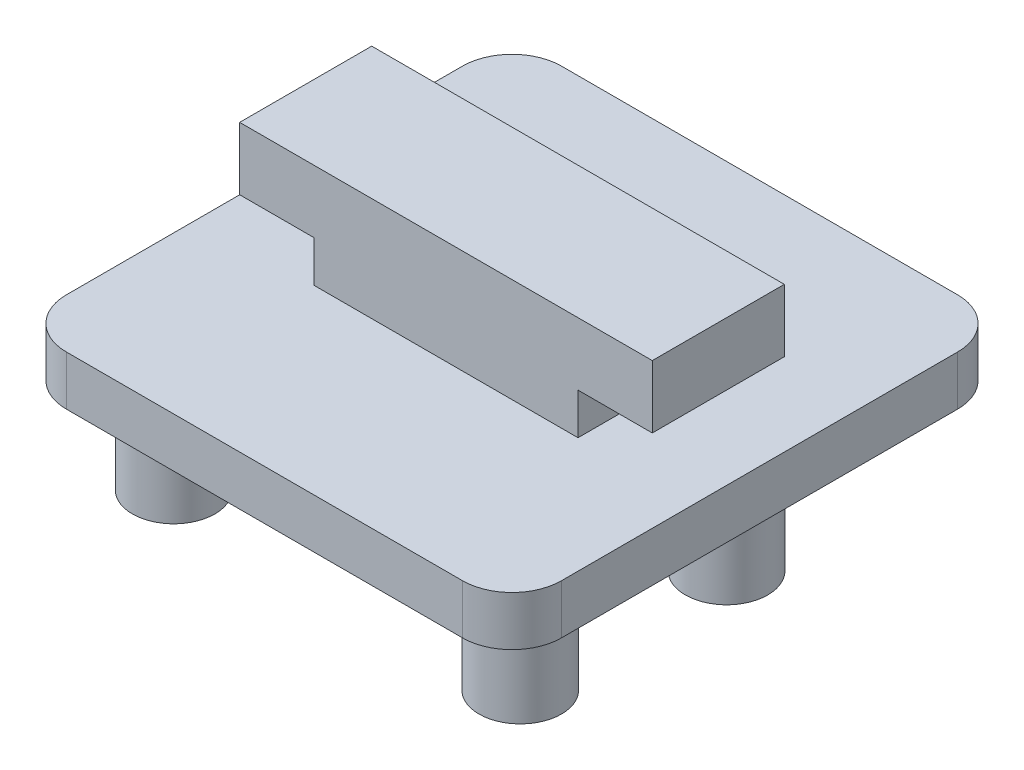
from build123d import *

# Parameters (mm, degrees)
EXTRUDE_2_DEPTH = 3
SKETCH_4_R      = 2.5
SKETCH_4_R_2    = 0.95
SKETCH_4_R_3    = 0.973149492
EXTRUDE_5_DEPTH = 6
SKETCH_6_W      = 16
SKETCH_6_H      = 8
EXTRUDE_6_DEPTH = 2.5
EXTRUDE_7_DEPTH = 3.8


with BuildPart() as part:
    # Эскиз1 → Бобышка-Вытянуть2 (new body)
    with BuildSketch(Plane(origin=(0, 0, 0), x_dir=(1, 0, 0), z_dir=(0, 1, 0))):
        with BuildLine():
            Line((-21.078452696, 29.831456886), (2.921547304, 29.831456886))
            ThreePointArc((2.921547304, 29.831456886), (5.042867648, 28.95277723), (5.921547304, 26.831456886))
            Line((5.921547304, 26.831456886), (5.921547304, 2.831456886))
            ThreePointArc((5.921547304, 2.831456886), (5.042867648, 0.710136543), (2.921547304, -0.168543114))
            Line((2.921547304, -0.168543114), (-21.078452696, -0.168543114))
            ThreePointArc((-21.078452696, -0.168543114), (-23.19977304, 0.710136543), (-24.078452696, 2.831456886))
            Line((-24.078452696, 2.831456886), (-24.078452696, 26.831456886))
            ThreePointArc((-24.078452696, 26.831456886), (-23.19977304, 28.95277723), (-21.078452696, 29.831456886))
        make_face()
    extrude(amount=EXTRUDE_2_DEPTH)

    # Эскиз4 → Бобышка-Вытянуть5 (add)
    # profile 1 of 4: a face of its own
    with BuildSketch(Plane.XZ):
        with Locations(Location((1.421547304, -4.831456886, 0), (0, 0, 90))):
            Circle(SKETCH_4_R)
        with Locations(Location((1.421547304, -4.831456886, 0), (0, 0, 270))):
            Circle(SKETCH_4_R_2, mode=Mode.SUBTRACT)
    # profile 2 of 4: a face of its own
    with BuildSketch(Plane.XZ):
        with Locations(Location((-19.578452696, -4.831456886, 0), (0, 0, 90))):
            Circle(SKETCH_4_R)
        with Locations(Location((-19.578452696, -4.831456886, 0), (0, 0, 270))):
            Circle(SKETCH_4_R_3, mode=Mode.SUBTRACT)
    # profile 3 of 4: a face of its own
    with BuildSketch(Plane.XZ):
        with Locations(Location((1.421547304, -17.331456886, 0), (0, 0, 90))):
            Circle(SKETCH_4_R)
        with Locations(Location((1.421547304, -17.331456886, 0), (0, 0, 270))):
            Circle(SKETCH_4_R_2, mode=Mode.SUBTRACT)
    # profile 4 of 4: a face of its own
    with BuildSketch(Plane.XZ):
        with Locations(Location((-19.578452696, -17.331456886, 0), (0, 0, 90))):
            Circle(SKETCH_4_R)
        with Locations(Location((-19.578452696, -17.331456886, 0), (0, 0, 270))):
            Circle(SKETCH_4_R_2, mode=Mode.SUBTRACT)
    extrude(amount=EXTRUDE_5_DEPTH)

    # Эскиз6 → Бобышка-Вытянуть6 (add)
    with BuildSketch(Plane(origin=(0, 3, 0), x_dir=(1, 0, 0), z_dir=(0, 1, 0))):
        with Locations((-9.078452696, 14.831456886)):
            Rectangle(SKETCH_6_W, SKETCH_6_H)
    extrude(amount=EXTRUDE_6_DEPTH)

    # Эскиз7 → Бобышка-Вытянуть7 (add)
    with BuildSketch(Plane(origin=(0, 5.5, 0), x_dir=(1, 0, 0), z_dir=(0, 1, 0))):
        Polygon((-9.078452696, 18.831456886), (-21.578452696, 18.831456886), (-21.578452696, 10.831456886), (3.421547304, 10.831456886), (3.421547304, 18.831456886), align=None)
    extrude(amount=EXTRUDE_7_DEPTH)


solid = part.part
